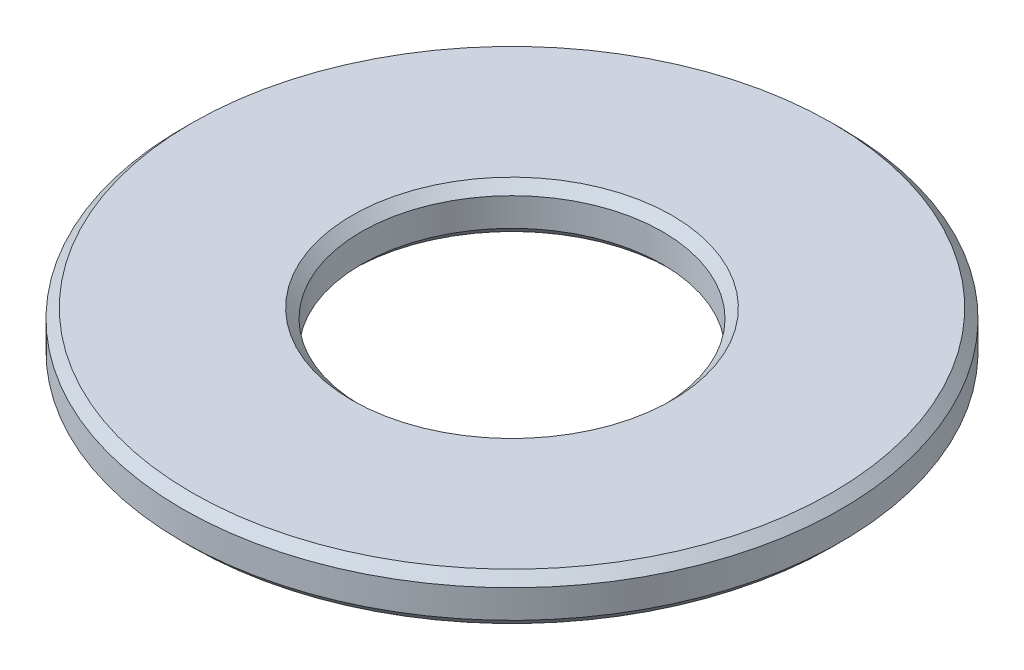
from build123d import *

# Parameters (mm, degrees)
SKETCH1_R           = 3.5
SKETCH1_R_2         = 1.6
BOSS_EXTRUDE1_DEPTH = 0.5
CHAMFER1_SIZE       = 0.1


with BuildPart() as part:
    # Sketch1 → Boss-Extrude1 (new body)
    with BuildSketch(Plane(origin=(0, 0, 0), x_dir=(1, 0, 0), z_dir=(0, 1, 0))):
        with Locations(Location((0, 0, 0), (0, 0, 270))):
            Circle(SKETCH1_R)
        with Locations(Location((0, 0, 0), (0, 0, 270))):
            Circle(SKETCH1_R_2, mode=Mode.SUBTRACT)
    extrude(amount=BOSS_EXTRUDE1_DEPTH)

    # Chamfer1
    chamfer1_edges = [part.edges().sort_by_distance(p)[0] for p in [
        (0, 0, -3.5),
        (0, 0.5, -3.5),
        (0, 0, -1.6),
        (0, 0.5, -1.6),
    ]]
    chamfer(chamfer1_edges, length=CHAMFER1_SIZE)


solid = part.part
